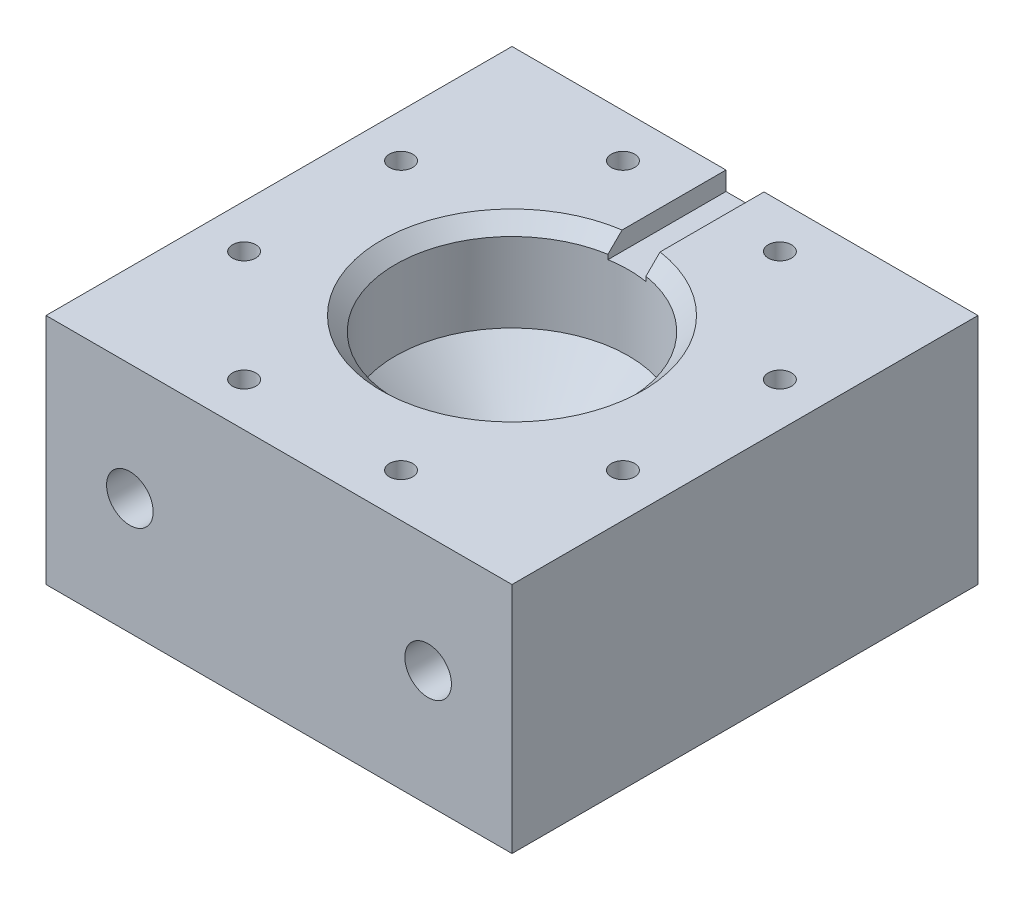
from build123d import *

# Parameters (mm, degrees)
ESQUISSE1_W                                   = 50
ESQUISSE1_H                                   = 50
BOSS_EXTRU_1_DEPTH                            = 25
TROU_POUR_TARAUDAGE_POUR_TROU_TARAUD_M3_D     = 2.5
TROU_POUR_TARAUDAGE_POUR_TROU_TARAUD_M3_DEPTH = 10
TROU_POUR_TARAUDAGE_POUR_TROU_TARAUD_M3_TIP   = 0.751075774
TROU_POUR_TARAUDAGE_POUR_TROU_TARAUD_M6_D     = 5
TROU_POUR_TARAUDAGE_POUR_TROU_TARAUD_M6_DEPTH = 10
TROU_POUR_TARAUDAGE_POUR_TROU_TARAUD_M6_TIP   = 1.502151548
ESQUISSE12_W                                  = 4.07874476
ESQUISSE12_H                                  = 14
ENL_V_MAT_EXTRU_1_DEPTH                       = 2
CHANFREIN1_SIZE                               = 1.5


with BuildPart() as part:
    # Esquisse1 → Boss.-Extru.1 (new body)
    with BuildSketch(Plane(origin=(0, 0, 0), x_dir=(1, 0, 0), z_dir=(0, 1, 0))):
        Rectangle(ESQUISSE1_W, ESQUISSE1_H)
    extrude(amount=BOSS_EXTRU_1_DEPTH)

    # Esquisse2 → Enlèvement de matière-Révolution1 (revolve, cut)
    with BuildSketch(Plane.XY, mode=Mode.PRIVATE) as enl_vement_de_mati_re_r_volution1_sk:
        Polygon((0, 0), (4.5, 0), (4.5, 7), (12.5, 15), (12.5, 25), (0, 25), align=None)
    revolve(enl_vement_de_mati_re_r_volution1_sk.sketch.rotate(Axis((0, 0, 0), (0, 1, 0)), 90), axis=Axis((0, 0, 0), (0, 1, 0)), mode=Mode.SUBTRACT)

    # Trou pour taraudage pour trou taraudé M31
    with Locations(Plane(origin=(0, 25, 0), x_dir=(1, 0, 0), z_dir=(0, 1, 0))):
        with Locations((-8.419035512, 20.325349715), (8.419035512, 20.325349715), (20.325349715, 8.419035512), (20.325349715, -8.419035512), (8.419035512, -20.325349715), (-8.419035512, -20.325349715), (-20.325349715, -8.419035512), (-20.325349715, 8.419035512)):
            Hole(TROU_POUR_TARAUDAGE_POUR_TROU_TARAUD_M3_D / 2, depth=TROU_POUR_TARAUDAGE_POUR_TROU_TARAUD_M3_DEPTH)
            with Locations((0, 0, -(TROU_POUR_TARAUDAGE_POUR_TROU_TARAUD_M3_DEPTH + TROU_POUR_TARAUDAGE_POUR_TROU_TARAUD_M3_TIP / 2))):  # 118° drill point
                Cone(0, TROU_POUR_TARAUDAGE_POUR_TROU_TARAUD_M3_D / 2, TROU_POUR_TARAUDAGE_POUR_TROU_TARAUD_M3_TIP, mode=Mode.SUBTRACT)

    # Trou pour taraudage pour trou taraudé M61
    with Locations(Plane.XY.offset(25)):
        with Locations((-16, 12.5), (16, 12.5)):
            Hole(TROU_POUR_TARAUDAGE_POUR_TROU_TARAUD_M6_D / 2, depth=TROU_POUR_TARAUDAGE_POUR_TROU_TARAUD_M6_DEPTH)
            with Locations((0, 0, -(TROU_POUR_TARAUDAGE_POUR_TROU_TARAUD_M6_DEPTH + TROU_POUR_TARAUDAGE_POUR_TROU_TARAUD_M6_TIP / 2))):  # 118° drill point
                Cone(0, TROU_POUR_TARAUDAGE_POUR_TROU_TARAUD_M6_D / 2, TROU_POUR_TARAUDAGE_POUR_TROU_TARAUD_M6_TIP, mode=Mode.SUBTRACT)

    # Esquisse12 → Enlèv. mat.-Extru.1 (cut)
    with BuildSketch(Plane(origin=(0, 25, 0), x_dir=(1, 0, 0), z_dir=(0, 1, 0))):
        with Locations((0, 18)):
            Rectangle(ESQUISSE12_W, ESQUISSE12_H)
    extrude(amount=-ENL_V_MAT_EXTRU_1_DEPTH, mode=Mode.SUBTRACT)

    # Chanfrein1
    chanfrein1_edges = [part.edges().sort_by_distance(p)[0] for p in [
        (0, 25, 12.5),
    ]]
    chamfer(chanfrein1_edges, length=CHANFREIN1_SIZE)


solid = part.part
